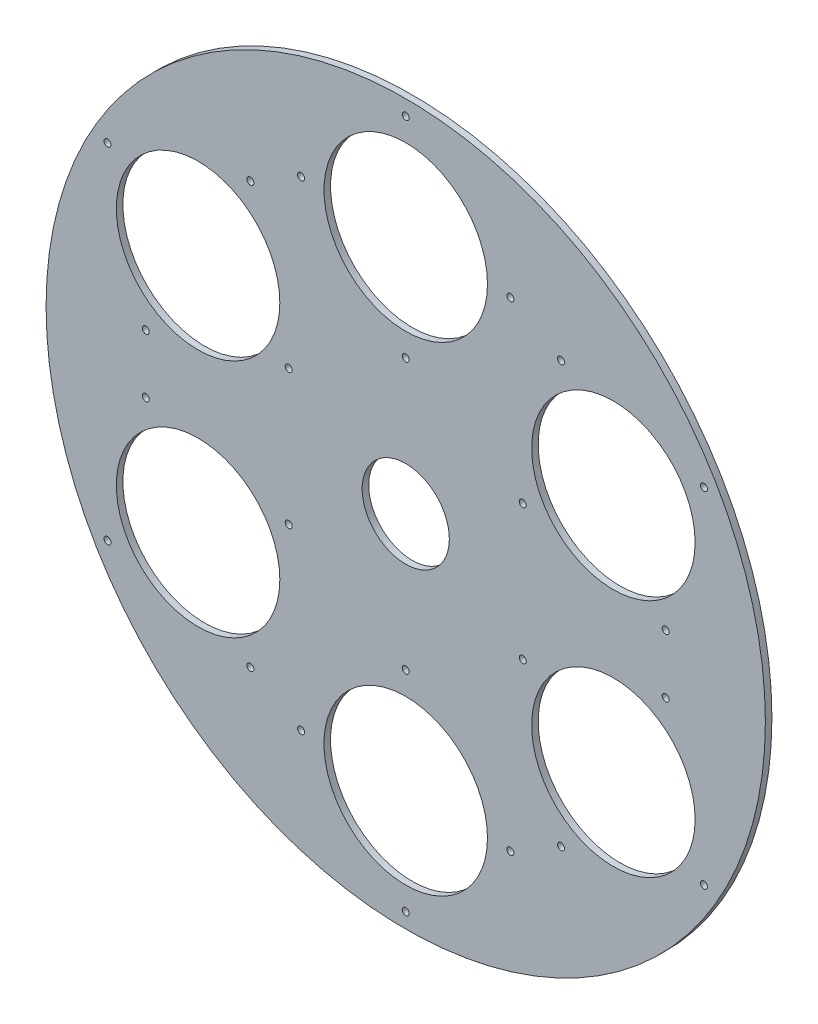
from build123d import *

# Parameters (mm, degrees)
SKETCH11_R          = 165
SKETCH11_R_2        = 1.6
SKETCH11_R_3        = 37.5
SKETCH11_R_4        = 20
BOSS_EXTRUDE4_DEPTH = 3


with BuildPart() as part:
    # Sketch11 → Boss-Extrude4 (new body)
    with BuildSketch(Plane.XY):
        Circle(SKETCH11_R)
        with Locations((-48, 110)):
            Circle(SKETCH11_R_2, mode=Mode.SUBTRACT)
        with Locations((0, 158)):
            Circle(SKETCH11_R_2, mode=Mode.SUBTRACT)
        with Locations((48, 110)):
            Circle(SKETCH11_R_2, mode=Mode.SUBTRACT)
        with Locations((0, 62)):
            Circle(SKETCH11_R_2, mode=Mode.SUBTRACT)
        with Locations((71.262794416, 96.569219382)):
            Circle(SKETCH11_R_2, mode=Mode.SUBTRACT)
        with Locations((136.832013798, 79)):
            Circle(SKETCH11_R_2, mode=Mode.SUBTRACT)
        with Locations((119.262794416, 13.430780618)):
            Circle(SKETCH11_R_2, mode=Mode.SUBTRACT)
        with Locations((53.693575035, 31)):
            Circle(SKETCH11_R_2, mode=Mode.SUBTRACT)
        with Locations((119.262794416, -13.430780618)):
            Circle(SKETCH11_R_2, mode=Mode.SUBTRACT)
        with Locations((136.832013798, -79)):
            Circle(SKETCH11_R_2, mode=Mode.SUBTRACT)
        with Locations((71.262794416, -96.569219382)):
            Circle(SKETCH11_R_2, mode=Mode.SUBTRACT)
        with Locations((53.693575035, -31)):
            Circle(SKETCH11_R_2, mode=Mode.SUBTRACT)
        with Locations((48, -110)):
            Circle(SKETCH11_R_2, mode=Mode.SUBTRACT)
        with Locations((0, -158)):
            Circle(SKETCH11_R_2, mode=Mode.SUBTRACT)
        with Locations((-48, -110)):
            Circle(SKETCH11_R_2, mode=Mode.SUBTRACT)
        with Locations((0, -62)):
            Circle(SKETCH11_R_2, mode=Mode.SUBTRACT)
        with Locations((-71.262794416, -96.569219382)):
            Circle(SKETCH11_R_2, mode=Mode.SUBTRACT)
        with Locations((-136.832013798, -79)):
            Circle(SKETCH11_R_2, mode=Mode.SUBTRACT)
        with Locations((-119.262794416, -13.430780618)):
            Circle(SKETCH11_R_2, mode=Mode.SUBTRACT)
        with Locations((-53.693575035, -31)):
            Circle(SKETCH11_R_2, mode=Mode.SUBTRACT)
        with Locations((-119.262794416, 13.430780618)):
            Circle(SKETCH11_R_2, mode=Mode.SUBTRACT)
        with Locations((-136.832013798, 79)):
            Circle(SKETCH11_R_2, mode=Mode.SUBTRACT)
        with Locations((-71.262794416, 96.569219382)):
            Circle(SKETCH11_R_2, mode=Mode.SUBTRACT)
        with Locations((-53.693575035, 31)):
            Circle(SKETCH11_R_2, mode=Mode.SUBTRACT)
        with Locations((0, 110)):
            Circle(SKETCH11_R_3, mode=Mode.SUBTRACT)
        with Locations((95.262794416, 55)):
            Circle(SKETCH11_R_3, mode=Mode.SUBTRACT)
        with Locations((95.262794416, -55)):
            Circle(SKETCH11_R_3, mode=Mode.SUBTRACT)
        with Locations((0, -110)):
            Circle(SKETCH11_R_3, mode=Mode.SUBTRACT)
        with Locations((-95.262794416, -55)):
            Circle(SKETCH11_R_3, mode=Mode.SUBTRACT)
        with Locations((-95.262794416, 55)):
            Circle(SKETCH11_R_3, mode=Mode.SUBTRACT)
        Circle(SKETCH11_R_4, mode=Mode.SUBTRACT)
    extrude(amount=BOSS_EXTRUDE4_DEPTH)


solid = part.part
